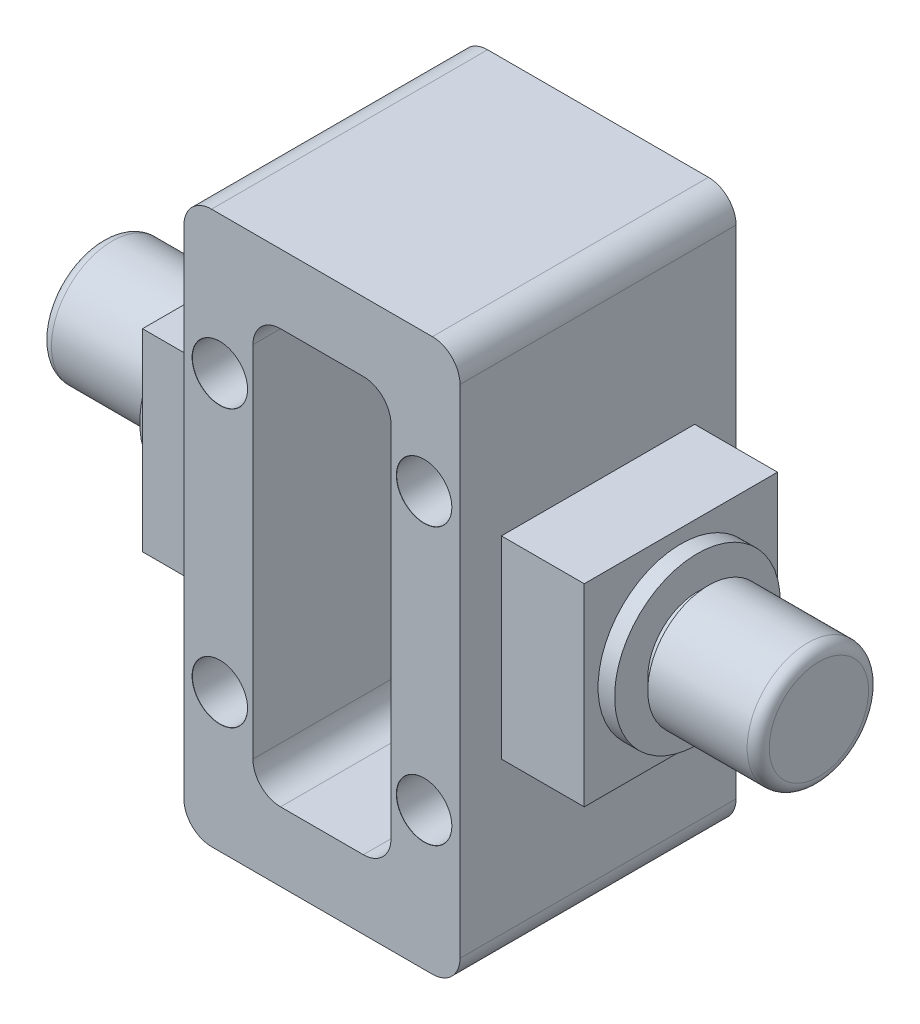
from build123d import *

# Parameters (mm, degrees)
SKETCH1_W                        = 50
SKETCH1_H                        = 100
BOSS_EXTRUDE1_DEPTH              = 25
FILLET1_R                        = 5
SKETCH2_W                        = 25
SKETCH2_H                        = 75
CUT_EXTRUDE1_DEPTH               = 50
FILLET2_R                        = 5
SKETCH4_W                        = 35
SKETCH4_H                        = 35
BOSS_EXTRUDE2_DEPTH              = 15
FILLET7_R                        = 2
FILLET8_R                        = 2
F_10_0MM_DOWEL_HOLE1_D           = 10
F_10_0MM_DOWEL_HOLE1_CSINK_D     = 10.05
F_10_0MM_DOWEL_HOLE1_CSINK_ANGLE = 90


with BuildPart() as part:
    # Sketch1 → Boss-Extrude1 (new, symmetric)
    with BuildSketch(Plane(origin=(0, 0, 0), x_dir=(0, 0, -1), z_dir=(1, 0, 0))):
        Rectangle(SKETCH1_W, SKETCH1_H)
    extrude(amount=BOSS_EXTRUDE1_DEPTH, both=True)

    # Fillet1
    fillet1_edges = [part.edges().sort_by_distance(p)[0] for p in [
        (25, -50, 0),
        (-25, -50, 0),
        (-25, 50, 0),
        (25, 50, 0),
    ]]
    fillet(fillet1_edges, radius=FILLET1_R)

    # Sketch2 → Cut-Extrude1 (cut)
    with BuildSketch(Plane.XY.offset(25)):
        Rectangle(SKETCH2_W, SKETCH2_H)
    extrude(amount=-CUT_EXTRUDE1_DEPTH, mode=Mode.SUBTRACT)

    # Fillet2
    fillet2_edges = [part.edges().sort_by_distance(p)[0] for p in [
        (12.5, 37.5, 0),
        (12.5, -37.5, 0),
        (-12.5, -37.5, 0),
        (-12.5, 37.5, 0),
    ]]
    fillet(fillet2_edges, radius=FILLET2_R)

    # Sketch4 → Boss-Extrude2 (add)
    with BuildSketch(Plane.ZY.offset(25)):
        Rectangle(SKETCH4_W, SKETCH4_H)
    boss_extrude2 = extrude(amount=BOSS_EXTRUDE2_DEPTH)

    # Mirror1: Boss-Extrude2 across plane
    add(boss_extrude2.mirror(Plane(origin=(0, 0, 0), x_dir=(0, 0, 1), z_dir=(1, 0, 0))))

    # Sketch6 → Revolve1 (revolve)
    with BuildSketch(Plane.XY, mode=Mode.PRIVATE) as revolve1_sk:
        Polygon((-40, 15), (-43, 15), (-43, 9), (-45, 9), (-45, 11), (-65, 11), (-65, 0), (-40, 0), align=None)
    revolve1 = revolve(revolve1_sk.sketch.rotate(Axis((0, 0, 0), (-1, 0, 0)), 90), axis=Axis((0, 0, 0), (-1, 0, 0)))

    # Mirror2: Revolve1 across plane
    add(revolve1.mirror(Plane(origin=(0, 0, 0), x_dir=(0, 0, 1), z_dir=(1, 0, 0))))

    # Fillet7
    fillet7_edges = [part.edges().sort_by_distance(p)[0] for p in [
        (-65, 0, 11),
    ]]
    fillet(fillet7_edges, radius=FILLET7_R)

    # Fillet8
    fillet8_edges = [part.edges().sort_by_distance(p)[0] for p in [
        (65, 0, 11),
    ]]
    fillet(fillet8_edges, radius=FILLET8_R)

    # Ø10.0mm Dowel Hole1 (through all)
    with Locations(Plane.XY.offset(25)):
        with Locations((18.5, 25), (18.5, -25), (-18.5, -25), (-18.5, 25)):
            CounterSinkHole(F_10_0MM_DOWEL_HOLE1_D / 2, F_10_0MM_DOWEL_HOLE1_CSINK_D / 2, counter_sink_angle=F_10_0MM_DOWEL_HOLE1_CSINK_ANGLE)


solid = part.part
